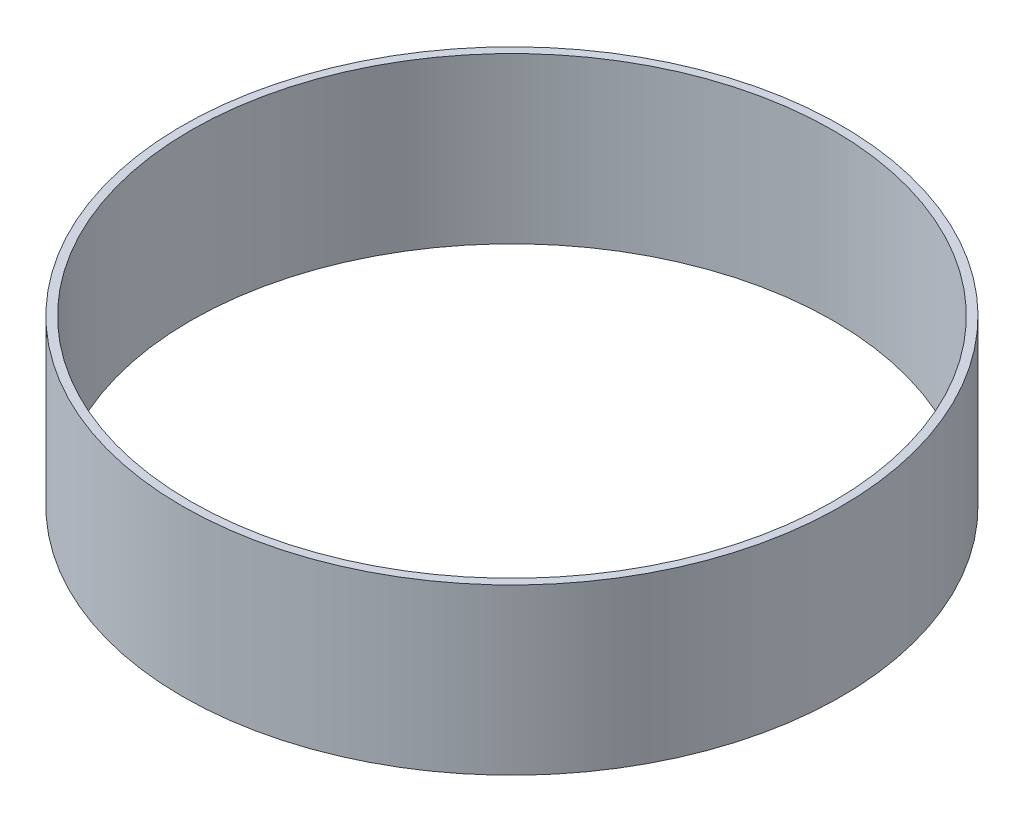
from build123d import *

# Parameters (mm, degrees)
SCHIZZO1_R                = 60
SCHIZZO1_R_2              = 58.5
ESTRUSIONE_SOTTILE1_DEPTH = 15


with BuildPart() as part:
    # Schizzo1 → Estrusione-Sottile1 (new, symmetric)
    with BuildSketch(Plane(origin=(0, 0, 0), x_dir=(1, 0, 0), z_dir=(0, 1, 0))):
        Circle(SCHIZZO1_R)
        Circle(SCHIZZO1_R_2, mode=Mode.SUBTRACT)
    extrude(amount=ESTRUSIONE_SOTTILE1_DEPTH, both=True)


solid = part.part
